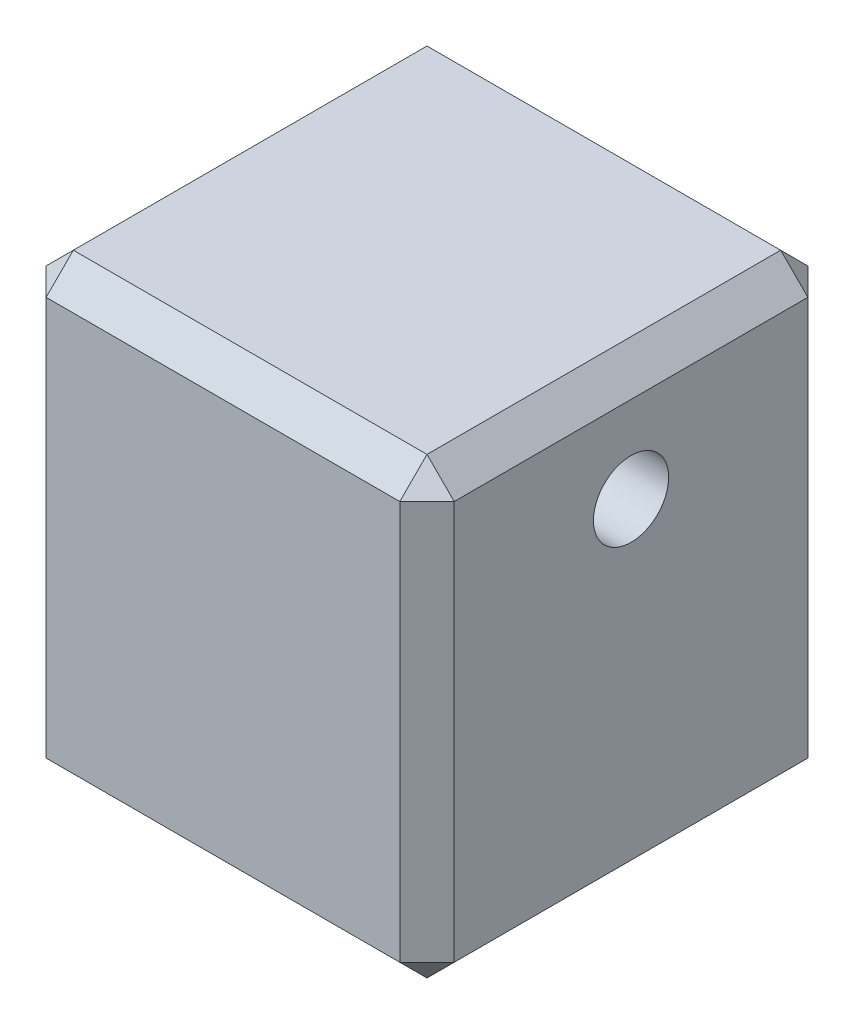
from build123d import *

# Parameters (mm, degrees)
SKETCH1_W           = 45
SKETCH1_H           = 45
BOSS_EXTRUDE1_DEPTH = 50
SKETCH2_R           = 4.15
CUT_EXTRUDE1_DEPTH  = 30
SKETCH3_R           = 4.15
CUT_EXTRUDE2_DEPTH  = 30
CHAMFER1_SIZE       = 3


with BuildPart() as part:
    # Sketch1 → Boss-Extrude1 (new body)
    with BuildSketch(Plane(origin=(0, 0, 0), x_dir=(1, 0, 0), z_dir=(0, 1, 0))):
        Rectangle(SKETCH1_W, SKETCH1_H)
    extrude(amount=BOSS_EXTRUDE1_DEPTH)

    # Sketch2 → Cut-Extrude1 (cut)
    with BuildSketch(Plane(origin=(0, 0, -22.5), x_dir=(-1, 0, 0), z_dir=(0, 0, -1))):
        with Locations((0, 12.5)):
            Circle(SKETCH2_R)
    extrude(amount=-CUT_EXTRUDE1_DEPTH, mode=Mode.SUBTRACT)

    # Sketch3 → Cut-Extrude2 (cut)
    with BuildSketch(Plane.ZY.offset(-22.5)):
        with Locations((0, 37.5)):
            Circle(SKETCH3_R)
    extrude(amount=CUT_EXTRUDE2_DEPTH, mode=Mode.SUBTRACT)

    # Chamfer1
    chamfer1_edges = [part.edges().sort_by_distance(p)[0] for p in [
        (-22.5, 50, 0),
        (0, 50, 22.5),
        (22.5, 50, 0),
        (0, 0, 22.5),
        (-22.5, 0, 0),
        (0, 0, -22.5),
        (22.5, 0, 0),
        (22.5, 25, 22.5),
        (-22.5, 25, 22.5),
        (-22.5, 25, -22.5),
        (22.5, 25, -22.5),
        (0, 50, -22.5),
    ]]
    chamfer(chamfer1_edges, length=CHAMFER1_SIZE)


solid = part.part
